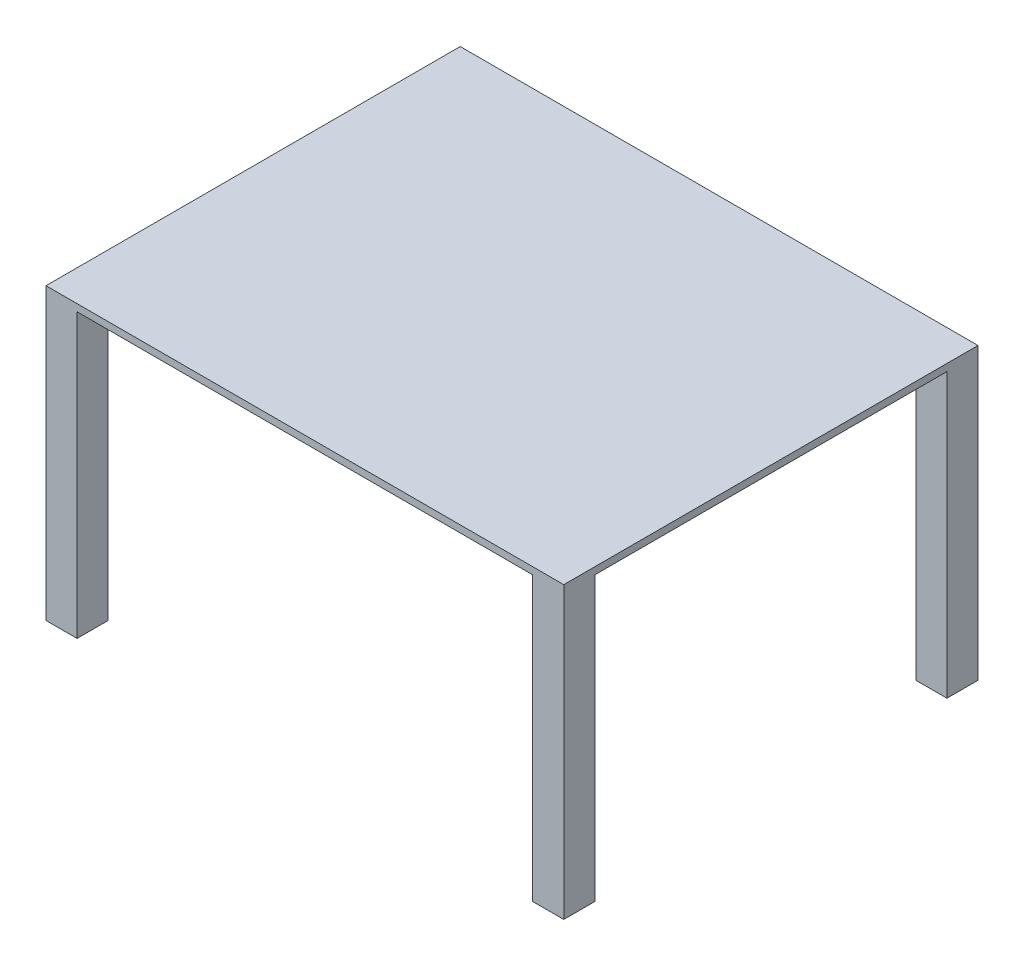
from build123d import *

# Parameters (mm, degrees)
CROQUIS1_W              = 1250
CROQUIS1_H              = 1000
SALIENTE_EXTRUIR1_DEPTH = 17
CROQUIS2_W              = 75
CROQUIS2_H              = 75
SALIENTE_EXTRUIR2_DEPTH = 700


with BuildPart() as part:
    # Croquis1 → Saliente-Extruir1 (new body)
    with BuildSketch(Plane(origin=(0, 0, 0), x_dir=(1, 0, 0), z_dir=(0, 1, 0))):
        Rectangle(CROQUIS1_W, CROQUIS1_H)
    extrude(amount=SALIENTE_EXTRUIR1_DEPTH)

    # Croquis2 → Saliente-Extruir2 (add)
    with BuildSketch(Plane(origin=(0, 17, 0), x_dir=(1, 0, 0), z_dir=(0, 1, 0))):
        with Locations((-587.5, -462.5)):
            Rectangle(CROQUIS2_W, CROQUIS2_H)
        with Locations((-587.5, 462.5)):
            Rectangle(CROQUIS2_W, CROQUIS2_H)
        with Locations((587.5, -462.5)):
            Rectangle(CROQUIS2_W, CROQUIS2_H)
        with Locations((587.5, 462.5)):
            Rectangle(CROQUIS2_W, CROQUIS2_H)
    extrude(amount=-SALIENTE_EXTRUIR2_DEPTH)


solid = part.part
